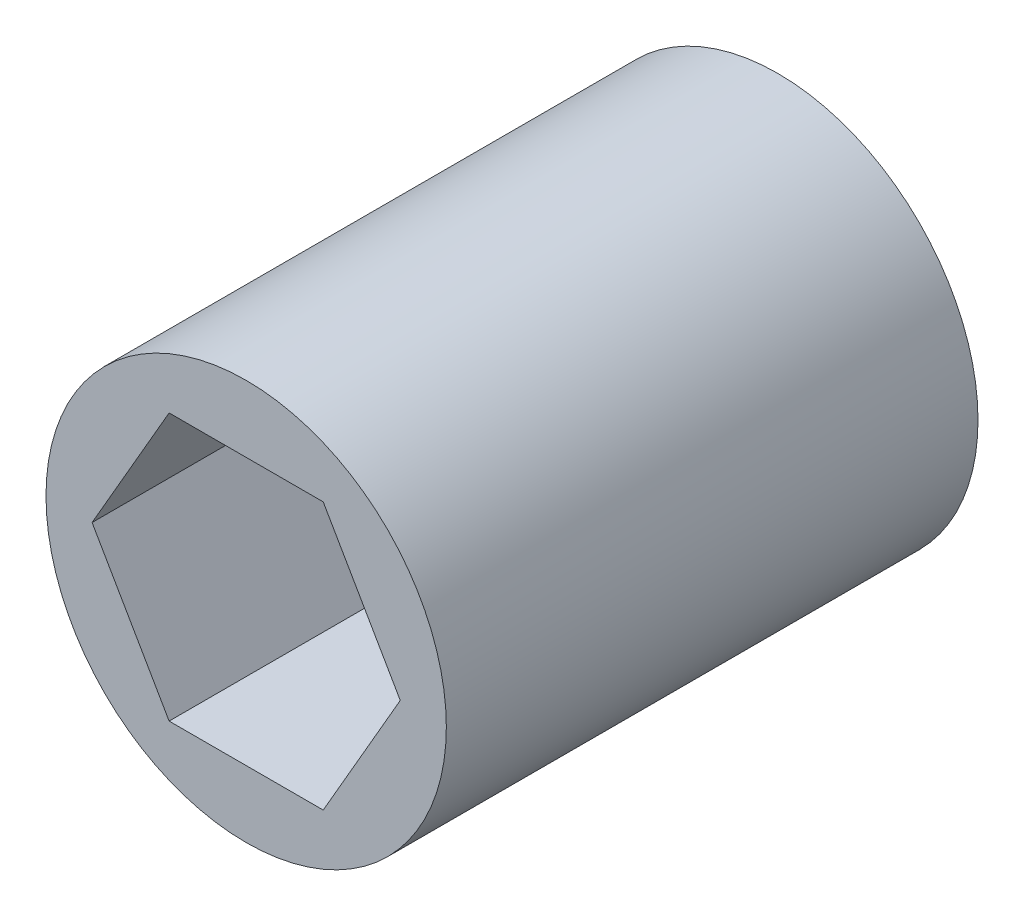
from build123d import *

# Parameters (mm, degrees)
SKETCH1_R           = 9.525
BOSS_EXTRUDE1_DEPTH = 25.2984


with BuildPart() as part:
    # Sketch1 → Boss-Extrude1 (new body)
    with BuildSketch(Plane.XY):
        Circle(SKETCH1_R)
        Polygon((-3.666174209, 6.35), (-7.332348419, 0), (-3.666174209, -6.35), (3.666174209, -6.35), (7.332348419, 0), (3.666174209, 6.35), align=None, mode=Mode.SUBTRACT)
    extrude(amount=BOSS_EXTRUDE1_DEPTH)


solid = part.part
